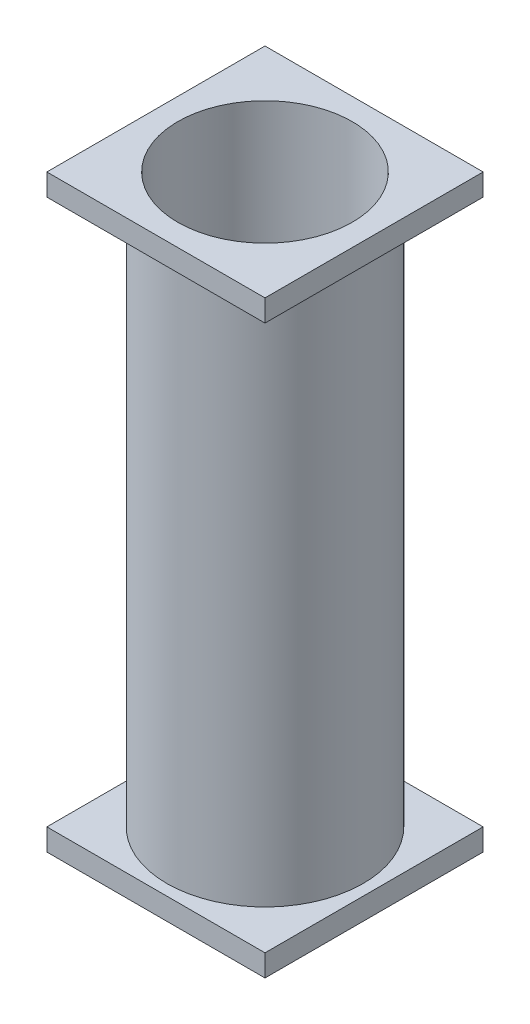
from build123d import *

# Parameters (mm, degrees)
SKETCH1_W           = 20
SKETCH1_H           = 20
SKETCH1_R           = 8
BOSS_EXTRUDE1_DEPTH = 2
SKETCH2_R           = 9
SKETCH2_R_2         = 8
BOSS_EXTRUDE3_DEPTH = 50
SKETCH3_W           = 20
SKETCH3_H           = 20
SKETCH3_R           = 8
BOSS_EXTRUDE5_DEPTH = 2


with BuildPart() as part:
    # Sketch1 → Boss-Extrude1 (new body)
    with BuildSketch(Plane(origin=(0, 0, 0), x_dir=(1, 0, 0), z_dir=(0, 1, 0))):
        with Locations((-10, 10)):
            Rectangle(SKETCH1_W, SKETCH1_H)
        with Locations(Location((-10, 10, 0), (0, 0, 270))):
            Circle(SKETCH1_R, mode=Mode.SUBTRACT)
    extrude(amount=BOSS_EXTRUDE1_DEPTH)

    # Sketch2 → Boss-Extrude3 (add)
    with BuildSketch(Plane(origin=(0, 2, 0), x_dir=(1, 0, 0), z_dir=(0, 1, 0))):
        with Locations(Location((-10, 10, 0), (0, 0, 270))):
            Circle(SKETCH2_R)
        with Locations(Location((-10, 10, 0), (0, 0, 270))):
            Circle(SKETCH2_R_2, mode=Mode.SUBTRACT)
    extrude(amount=BOSS_EXTRUDE3_DEPTH)

    # Sketch3 → Boss-Extrude5 (add)
    with BuildSketch(Plane(origin=(0, 52, 0), x_dir=(1, 0, 0), z_dir=(0, 1, 0))):
        with Locations((-10, 10)):
            Rectangle(SKETCH3_W, SKETCH3_H)
        with Locations(Location((-10, 10, 0), (0, 0, 270))):
            Circle(SKETCH3_R, mode=Mode.SUBTRACT)
    extrude(amount=BOSS_EXTRUDE5_DEPTH)


solid = part.part
